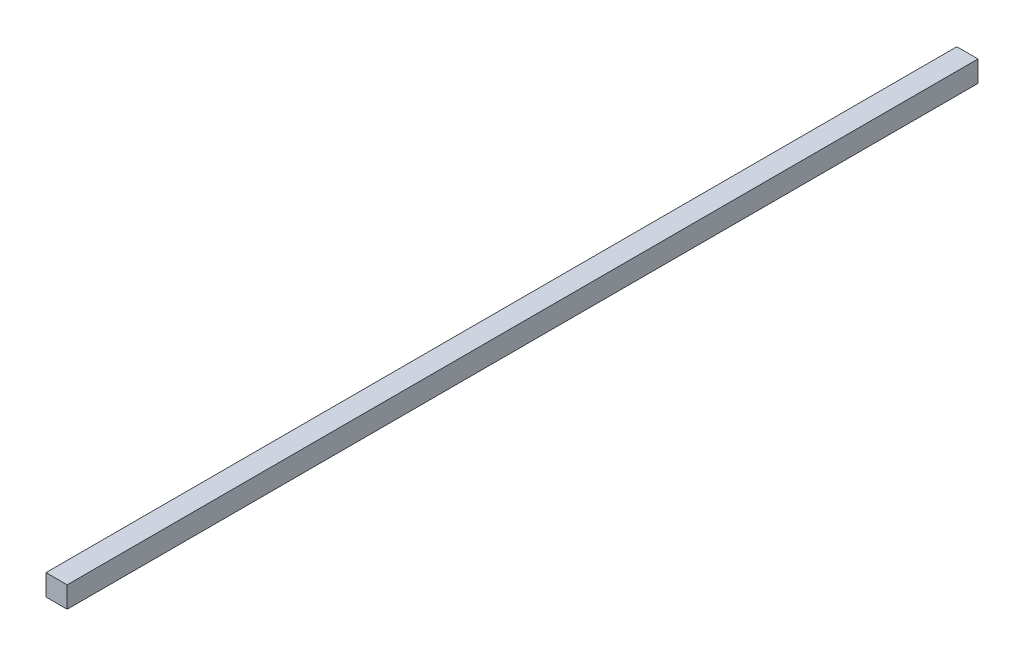
from build123d import *

# Parameters (mm, degrees)
SKETCH1_W           = 20
SKETCH1_H           = 20
BOSS_EXTRUDE1_DEPTH = 860


with BuildPart() as part:
    # Sketch1 → Boss-Extrude1 (new body)
    with BuildSketch(Plane.XY):
        Rectangle(SKETCH1_W, SKETCH1_H)
    extrude(amount=BOSS_EXTRUDE1_DEPTH)


solid = part.part
